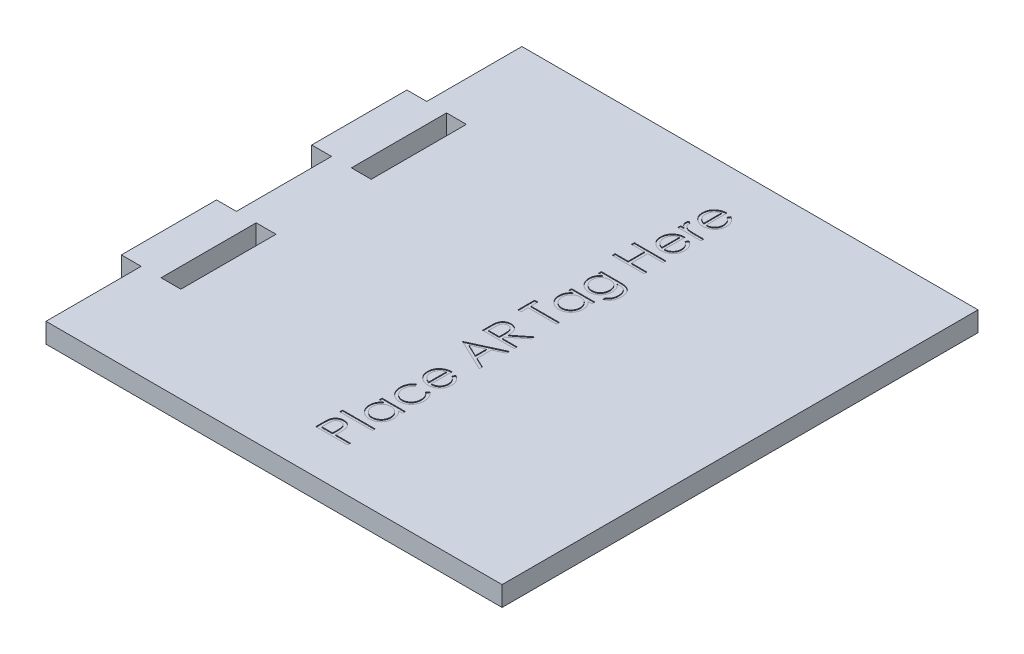
from build123d import *

# Parameters (mm, degrees)
SKETCH1_W           = 152.4
SKETCH1_H           = 152.4
BOSS_EXTRUDE1_DEPTH = 6.35
SKETCH2_W           = 6.35
SKETCH2_H           = 30.48
CUT_EXTRUDE1_DEPTH  = 108.95
SKETCH3_W           = 6.35
SKETCH3_H           = 30.48
CUT_EXTRUDE2_DEPTH  = 108.95
SKETCH4_W           = 10.420512821
SKETCH4_H           = 0.911794872
CUT_EXTRUDE3_DEPTH  = 0.254


with BuildPart() as part:
    # Sketch1 → Boss-Extrude1 (new body)
    with BuildSketch(Plane(origin=(0, 0, 0), x_dir=(1, 0, 0), z_dir=(0, 1, 0))):
        Rectangle(SKETCH1_W, SKETCH1_H)
    extrude(amount=BOSS_EXTRUDE1_DEPTH)

    # Sketch2 → Cut-Extrude1 (cut, through all)
    with BuildSketch(Plane(origin=(0, 6.35, 0), x_dir=(1, 0, 0), z_dir=(0, 1, 0))):
        with Locations((-60.325, -30.48)):
            Rectangle(SKETCH2_W, SKETCH2_H)
        with Locations((-60.325, 30.48)):
            Rectangle(SKETCH2_W, SKETCH2_H)
    extrude(amount=-CUT_EXTRUDE1_DEPTH, mode=Mode.SUBTRACT)

    # Sketch3 → Cut-Extrude2 (cut, through all)
    with BuildSketch(Plane(origin=(0, 6.35, 0), x_dir=(1, 0, 0), z_dir=(0, 1, 0))):
        with Locations((-73.025, -60.96)):
            Rectangle(SKETCH3_W, SKETCH3_H)
        with Locations((-73.025, 0)):
            Rectangle(SKETCH3_W, SKETCH3_H)
        with Locations((-73.025, 60.96)):
            Rectangle(SKETCH3_W, SKETCH3_H)
    extrude(amount=-CUT_EXTRUDE2_DEPTH, mode=Mode.SUBTRACT)

    # Sketch4 → Cut-Extrude3 (cut)
    # profile 1 of 14: a face of its own
    with BuildSketch(Plane(origin=(0, 6.35, 0), x_dir=(1, 0, 0), z_dir=(0, 1, 0))):
        with BuildLine():
            Line((2.54, -62.197435897), (2.54, -60.204919872))
            add(Edge.make_bspline(
                [(2.54, -60.204919872), (2.540150647, -60.067873356), (2.540439294, -59.805286145), (2.549190671, -59.428741869), (2.560879583, -59.086757048), (2.577083021, -58.780069085), (2.59623198, -58.507734354), (2.623089329, -58.270985165), (2.651131787, -58.067960624), (2.679641927, -57.946312188), (2.692644231, -57.890833333)],
                knots=[0, 0, 0, 0, 1.415646017, 2.712440637, 3.8905458, 4.950247383, 5.884950622, 6.709939814, 7.411656543, 8, 8, 8, 8], degree=3))
            add(Edge.make_bspline(
                [(2.692644231, -57.890833333), (2.711867557, -57.820603574), (2.749861237, -57.68179893), (2.825945048, -57.481780182), (2.916212534, -57.291519636), (3.018893817, -57.110168106), (3.139043345, -56.941028623), (3.268668078, -56.778462828), (3.416144919, -56.628209284), (3.576822403, -56.488232825), (3.748662642, -56.358856468), (3.934787752, -56.250156934), (4.129640888, -56.155113448), (4.335870266, -56.077296522), (4.553676105, -56.019428623), (4.781510542, -55.976467538), (5.019629765, -55.949073964), (5.182365742, -55.946459253), (5.265208333, -55.945128205)],
                knots=[0, 0, 0, 0, 0.999549623, 1.97554611, 2.93413192, 3.889860808, 4.833293765, 5.780583482, 6.742559327, 7.719844669, 8.705620613, 9.691528643, 10.674968152, 11.680406189, 12.713313868, 13.765869198, 14.862690416, 16, 16, 16, 16], degree=3))
            add(Edge.make_bspline(
                [(5.265208333, -55.945128205), (5.348746108, -55.946351541), (5.512193407, -55.94874508), (5.751309844, -55.977472583), (5.979818085, -56.016168225), (6.197211461, -56.075668239), (6.402198955, -56.153597393), (6.59791316, -56.245014324), (6.781024436, -56.355275086), (6.952197554, -56.481969792), (7.111593185, -56.622908134), (7.258056246, -56.777493806), (7.390729411, -56.945102724), (7.509910112, -57.125202217), (7.612834626, -57.319548064), (7.705021545, -57.525192715), (7.782443824, -57.743923629), (7.823171088, -57.895285898), (7.843878205, -57.97224359)],
                knots=[0, 0, 0, 0, 1.121902311, 2.195077645, 3.232258892, 4.234102512, 5.217864754, 6.176164875, 7.132989551, 8.084763148, 9.034132444, 9.988522005, 10.94243251, 11.903244335, 12.886203696, 13.894208494, 14.929344452, 16, 16, 16, 16], degree=3))
            add(Edge.make_bspline(
                [(7.843878205, -57.97224359), (7.857404085, -58.035896233), (7.887046838, -58.1753947), (7.920364461, -58.405120312), (7.947688553, -58.672724907), (7.973187614, -58.977297976), (7.986698929, -59.319549777), (8.002563416, -59.698695348), (8.010049001, -60.116017846), (8.010522183, -60.407087277), (8.010769231, -60.559054487)],
                knots=[0, 0, 0, 0, 0.601372724, 1.317943291, 2.144091499, 3.08771165, 4.142394186, 5.309582461, 6.595334295, 8, 8, 8, 8], degree=3))
            Line((8.010769231, -60.559054487), (8.010769231, -61.285641026))
            Line((8.010769231, -61.285641026), (12.7, -61.285641026))
            Line((12.7, -61.285641026), (12.7, -62.197435897))
            Line((12.7, -62.197435897), (2.54, -62.197435897))
        make_face()
        with BuildLine():
            Line((3.582051282, -61.285641026), (6.968717949, -61.285641026))
            Line((6.968717949, -61.285641026), (6.991105769, -59.506826923))
            add(Edge.make_bspline(
                [(6.991105769, -59.506826923), (6.991153595, -59.419973045), (6.991245922, -59.252303425), (6.979638098, -59.010108112), (6.966416742, -58.785372443), (6.946420207, -58.578941518), (6.920207916, -58.390091011), (6.887610311, -58.22045213), (6.852171529, -58.06748765), (6.792962117, -57.891531648), (6.701921569, -57.693751305), (6.569391741, -57.477691376), (6.397705679, -57.296001045), (6.205209305, -57.139063411), (5.991641735, -57.012071986), (5.761935228, -56.922484602), (5.519492864, -56.867320389), (5.353695698, -56.860430907), (5.269278846, -56.856923077)],
                knots=[0, 0, 0, 0, 1.160746174, 2.240796558, 3.240300023, 4.169675897, 5.012224395, 5.787635701, 6.478238024, 7.109103438, 8.265591281, 9.382545711, 10.479929969, 11.588830844, 12.694575677, 13.785760505, 14.872603606, 16, 16, 16, 16], degree=3))
            add(Edge.make_bspline(
                [(5.269278846, -56.856923077), (5.187596841, -56.860588396), (5.025223125, -56.867874596), (4.787249316, -56.922029366), (4.560146735, -57.013033988), (4.348299055, -57.139174434), (4.156226251, -57.292303435), (3.989089174, -57.470141548), (3.855626199, -57.673143737), (3.766165576, -57.860408454), (3.71378954, -58.028101704), (3.675960237, -58.173040809), (3.649874326, -58.337529743), (3.624913362, -58.520005611), (3.604764882, -58.720236733), (3.590773009, -58.93949573), (3.582670228, -59.177052449), (3.582262592, -59.341964646), (3.582051282, -59.427451923)],
                knots=[0, 0, 0, 0, 1.120540835, 2.227496496, 3.330685923, 4.466139262, 5.598993257, 6.692710361, 7.80064471, 8.921224235, 9.527843361, 10.209888745, 10.975318552, 11.811557897, 12.738105936, 13.73658638, 14.826690375, 16, 16, 16, 16], degree=3))
            Line((3.582051282, -59.427451923), (3.582051282, -61.285641026))
        make_face(mode=Mode.SUBTRACT)
    # profile 2 of 14: a face of its own
    with BuildSketch(Plane(origin=(0, 6.35, 0), x_dir=(1, 0, 0), z_dir=(0, 1, 0))):
        with Locations((7.48974359, -53.795897436)):
            Rectangle(SKETCH4_W, SKETCH4_H)
    # profile 3 of 14: a face of its own
    with BuildSketch(Plane(origin=(0, 6.35, 0), x_dir=(1, 0, 0), z_dir=(0, 1, 0))):
        with BuildLine():
            Line((5.275384615, -43.701025641), (12.7, -43.701025641))
            Line((12.7, -43.701025641), (12.7, -44.612820513))
            Line((12.7, -44.612820513), (11.415753205, -44.612820513))
            add(Edge.make_bspline(
                [(11.415753205, -44.612820513), (11.531790912, -44.715796714), (11.75857671, -44.917054915), (12.057573273, -45.25002661), (12.299678433, -45.607364176), (12.498054277, -45.980100965), (12.64646541, -46.371888027), (12.752141112, -46.780677615), (12.820035946, -47.20686028), (12.826819024, -47.497877143), (12.83025641, -47.645352564)],
                knots=[0, 0, 0, 0, 1.074325654, 2.099677833, 3.090439787, 4.057542011, 5.018572219, 5.985274637, 6.979019747, 8, 8, 8, 8], degree=3))
            add(Edge.make_bspline(
                [(12.83025641, -47.645352564), (12.826696427, -47.776468682), (12.819675982, -48.035035471), (12.765211695, -48.415394163), (12.677746804, -48.78142195), (12.556114508, -49.13346471), (12.394771323, -49.469244423), (12.201611586, -49.791636018), (11.971586776, -50.098969318), (11.708622671, -50.386559843), (11.42299608, -50.651393307), (11.118354149, -50.883799744), (10.796014204, -51.077574399), (10.460057392, -51.239612119), (10.107897511, -51.364424364), (9.740752361, -51.451433542), (9.359056042, -51.505834382), (9.099135598, -51.512851925), (8.967339744, -51.516410256)],
                knots=[0, 0, 0, 0, 1.033919861, 2.038935746, 3.024066025, 3.998881131, 4.97069526, 5.957263378, 6.95902576, 7.993208707, 9.027059324, 10.027763471, 11.009749337, 11.988697705, 12.965288445, 13.950418724, 14.960734635, 16, 16, 16, 16], degree=3))
            add(Edge.make_bspline(
                [(8.967339744, -51.516410256), (8.838267964, -51.512773059), (8.583100019, -51.505582517), (8.207822427, -51.452015456), (7.846363704, -51.361936871), (7.499887549, -51.235523691), (7.167974718, -51.073422473), (6.850390463, -50.87623694), (6.546259869, -50.643952852), (6.26273425, -50.376157294), (6.000836696, -50.086060932), (5.773226438, -49.775720159), (5.5766541, -49.452854863), (5.420905723, -49.112457095), (5.294895294, -48.759565156), (5.207713878, -48.39103744), (5.156341082, -48.008407257), (5.148901744, -47.748629143), (5.145128205, -47.616858974)],
                knots=[0, 0, 0, 0, 1.020392517, 2.01726096, 2.990465484, 3.961182959, 4.928053699, 5.906110375, 6.912531644, 7.948652711, 8.985773172, 9.998621852, 10.987621588, 11.969261332, 12.953316658, 13.946091881, 14.958173133, 16, 16, 16, 16], degree=3))
            add(Edge.make_bspline(
                [(5.145128205, -47.616858974), (5.149306441, -47.465333111), (5.157499766, -47.168198043), (5.225542983, -46.733518445), (5.340847498, -46.322492743), (5.496609811, -45.930757502), (5.707927094, -45.563704857), (5.967036679, -45.216765548), (6.28465107, -44.897320733), (6.525570182, -44.70929441), (6.649182692, -44.612820513)],
                knots=[0, 0, 0, 0, 1.039007978, 2.037445607, 3.008437381, 3.96246474, 4.921201921, 5.904967172, 6.925065498, 8, 8, 8, 8], degree=3))
            Line((6.649182692, -44.612820513), (5.275384615, -44.612820513))
            Line((5.275384615, -44.612820513), (5.275384615, -43.701025641))
        make_face()
        with BuildLine():
            add(Edge.make_bspline(
                [(6.056923077, -47.604647436), (6.061669353, -47.737927331), (6.071037746, -48.001000645), (6.144054111, -48.387249859), (6.265859664, -48.756666636), (6.431468586, -49.108676532), (6.643660878, -49.433463525), (6.893662577, -49.728827605), (7.185693617, -49.985661545), (7.509303045, -50.206538112), (7.858146051, -50.383852602), (8.222689526, -50.509326479), (8.596624587, -50.591925744), (8.850221629, -50.600374491), (8.977516026, -50.604615385)],
                knots=[0, 0, 0, 0, 1.031130969, 2.035288524, 3.029955243, 4.035265425, 5.037320146, 6.024362013, 7.021230137, 8.037832003, 9.049975902, 10.039737725, 11.016035826, 12, 12, 12, 12], degree=3))
            add(Edge.make_bspline(
                [(8.977516026, -50.604615385), (9.104043888, -50.599180019), (9.356603667, -50.588330593), (9.730506631, -50.511134929), (10.09423181, -50.37992717), (10.445878072, -50.202852447), (10.772649524, -49.979376331), (11.069925778, -49.722786657), (11.323838054, -49.426001505), (11.536541892, -49.098310708), (11.708253936, -48.74817041), (11.827759334, -48.379998179), (11.904908887, -48.000663226), (11.913921002, -47.742737897), (11.918461538, -47.612788462)],
                knots=[0, 0, 0, 0, 0.979154007, 1.954470061, 2.941101473, 3.965068436, 4.993389179, 5.998216918, 6.996159742, 8.005560442, 9.015493761, 10.005250788, 10.994993882, 12, 12, 12, 12], degree=3))
            add(Edge.make_bspline(
                [(11.918461538, -47.612788462), (11.913587233, -47.480881732), (11.903892723, -47.218532329), (11.83128946, -46.830705891), (11.70678793, -46.455627829), (11.539470753, -46.09585677), (11.331072902, -45.761027371), (11.087095315, -45.461531975), (10.805302352, -45.205290616), (10.49201069, -44.991950934), (10.150739255, -44.822762143), (9.787768052, -44.699053461), (9.402360326, -44.626724277), (9.138605844, -44.617519184), (9.003974359, -44.612820513)],
                knots=[0, 0, 0, 0, 1.01787422, 2.024450869, 3.03297362, 4.061474925, 5.080076323, 6.069755756, 7.033548292, 8.009625779, 8.9862229, 9.964937832, 10.961217871, 12, 12, 12, 12], degree=3))
            add(Edge.make_bspline(
                [(9.003974359, -44.612820513), (8.901393685, -44.615606258), (8.699482457, -44.621089487), (8.403020863, -44.662979368), (8.119313818, -44.729614241), (7.848063041, -44.823510551), (7.590768254, -44.94685668), (7.345582024, -45.095621623), (7.113779559, -45.272421443), (6.898552816, -45.474410069), (6.702242857, -45.695506771), (6.527014089, -45.929461209), (6.383064966, -46.179045229), (6.263928018, -46.440061542), (6.169123171, -46.712963016), (6.105876609, -46.999970301), (6.062448934, -47.298032731), (6.058784423, -47.501366424), (6.056923077, -47.604647436)],
                knots=[0, 0, 0, 0, 1.050140795, 2.067009409, 3.05949893, 4.030605086, 5.00011959, 5.97591094, 6.962425594, 7.979863591, 8.993523472, 9.986985069, 10.967611495, 11.937549037, 12.921786183, 13.919465291, 14.943216303, 16, 16, 16, 16], degree=3))
        make_face(mode=Mode.SUBTRACT)
    # profile 4 of 14: a face of its own
    with BuildSketch(Plane(origin=(0, 6.35, 0), x_dir=(1, 0, 0), z_dir=(0, 1, 0))):
        with BuildLine():
            Line((6.885272436, -34.322564103), (7.359487179, -35.085785256))
            add(Edge.make_bspline(
                [(7.359487179, -35.085785256), (7.255482471, -35.169474237), (7.050766859, -35.334201787), (6.786578024, -35.620247113), (6.559670268, -35.925080247), (6.37474738, -36.253910237), (6.231864541, -36.606275873), (6.13075743, -36.980787556), (6.067753114, -37.377391879), (6.060592239, -37.649288571), (6.056923077, -37.788605769)],
                knots=[0, 0, 0, 0, 1.026593902, 2.0206758, 2.988051866, 3.946915611, 4.916868779, 5.907761954, 6.927957743, 8, 8, 8, 8], degree=3))
            add(Edge.make_bspline(
                [(6.056923077, -37.788605769), (6.059990939, -37.899956341), (6.06603301, -38.119258265), (6.103800613, -38.441202985), (6.172429986, -38.747867644), (6.262856763, -39.041174388), (6.38405189, -39.319037089), (6.531545354, -39.582183755), (6.702959185, -39.832948491), (6.901545225, -40.064064518), (7.117513929, -40.275476721), (7.349027514, -40.458643854), (7.589151541, -40.618117923), (7.843882312, -40.743248357), (8.107392227, -40.845647137), (8.384655305, -40.913012931), (8.672119464, -40.957904732), (8.868115559, -40.96304084), (8.967339744, -40.965641026)],
                knots=[0, 0, 0, 0, 1.112346261, 2.190735716, 3.231507886, 4.247384806, 5.251966152, 6.253067467, 7.256802811, 8.280671706, 9.291813951, 10.270744147, 11.225547591, 12.165006084, 13.100104208, 14.043489273, 15.009504848, 16, 16, 16, 16], degree=3))
            add(Edge.make_bspline(
                [(8.967339744, -40.965641026), (9.097279795, -40.960397832), (9.356074004, -40.949955262), (9.737439081, -40.870531423), (10.105476011, -40.73763442), (10.45819512, -40.55809673), (10.785011473, -40.330203243), (11.078159542, -40.062662144), (11.33191377, -39.75518811), (11.542291712, -39.410526788), (11.711415987, -39.036760993), (11.831905886, -38.63793727), (11.904629333, -38.217313874), (11.913790587, -37.929330864), (11.918461538, -37.7825)],
                knots=[0, 0, 0, 0, 0.96628757, 1.924499989, 2.884001032, 3.87047137, 4.860396324, 5.839257425, 6.814467993, 7.816059692, 8.834901047, 9.858382822, 10.908076205, 12, 12, 12, 12], degree=3))
            add(Edge.make_bspline(
                [(11.918461538, -37.7825), (11.914689284, -37.647937522), (11.907275802, -37.383486544), (11.844780297, -36.996920939), (11.742473064, -36.62889697), (11.599804457, -36.279427715), (11.415393153, -35.949151759), (11.187927675, -35.640203068), (10.923951715, -35.346434105), (10.71982869, -35.173722881), (10.615897436, -35.085785256)],
                knots=[0, 0, 0, 0, 1.039848629, 2.043578496, 3.018386758, 3.987534228, 4.954977003, 5.934852016, 6.948509513, 8, 8, 8, 8], degree=3))
            Line((10.615897436, -35.085785256), (11.116570513, -34.322564103))
            add(Edge.make_bspline(
                [(11.116570513, -34.322564103), (11.183019023, -34.367812975), (11.315695492, -34.458160534), (11.502767557, -34.609189298), (11.677872783, -34.772097153), (11.840776453, -34.946248542), (11.995376874, -35.129369508), (12.134283159, -35.327715668), (12.265303101, -35.534891455), (12.383196468, -35.75332901), (12.489169104, -35.980769893), (12.580293188, -36.216894069), (12.658583553, -36.460675468), (12.720813108, -36.71240072), (12.770483428, -36.972566093), (12.803441601, -37.240498746), (12.828044132, -37.5161064), (12.829512591, -37.702388988), (12.83025641, -37.796746795)],
                knots=[0, 0, 0, 0, 0.954134338, 1.905101784, 2.851144739, 3.791306361, 4.734911809, 5.6936923, 6.663572882, 7.643865596, 8.638447847, 9.640600242, 10.646758161, 11.676244097, 12.717260333, 13.78922464, 14.880174919, 16, 16, 16, 16], degree=3))
            add(Edge.make_bspline(
                [(12.83025641, -37.796746795), (12.827664854, -37.940758219), (12.822585385, -38.223021655), (12.766886567, -38.636190143), (12.682606534, -39.030921869), (12.562667725, -39.407910511), (12.404274762, -39.764851311), (12.215227116, -40.104715807), (11.98927731, -40.423996827), (11.731793156, -40.720601266), (11.4523358, -40.991845927), (11.152520027, -41.227871443), (10.838970892, -41.427895693), (10.509712023, -41.592669133), (10.166093532, -41.721506589), (9.806016229, -41.810206592), (9.432535183, -41.867438845), (9.177862172, -41.874072711), (9.04875, -41.877435897)],
                knots=[0, 0, 0, 0, 1.113096611, 2.181677437, 3.217994567, 4.231807234, 5.234933164, 6.233258928, 7.234764453, 8.254006763, 9.267004511, 10.242118657, 11.199842941, 12.138404996, 13.084707599, 14.031460992, 15.002005182, 16, 16, 16, 16], degree=3))
            add(Edge.make_bspline(
                [(9.04875, -41.877435897), (8.961146316, -41.876155691), (8.786888128, -41.873609148), (8.528257878, -41.844400809), (8.273071929, -41.806668099), (8.024564949, -41.742730531), (7.778967879, -41.668880012), (7.539240933, -41.574608182), (7.304270112, -41.464022693), (7.074660702, -41.338468469), (6.854190039, -41.197131997), (6.645899401, -41.040722474), (6.447286596, -40.875130916), (6.265208479, -40.692610545), (6.092383421, -40.500906864), (5.933428409, -40.294596233), (5.787876275, -40.074861989), (5.653035613, -39.845004115), (5.532975082, -39.605156382), (5.429536883, -39.356768562), (5.341137405, -39.101337368), (5.271152657, -38.838454207), (5.212464365, -38.569863944), (5.175546274, -38.293450003), (5.149460407, -38.010269838), (5.146584279, -37.818518641), (5.145128205, -37.721442308)],
                knots=[0, 0, 0, 0, 0.990994727, 1.971252077, 2.943264845, 3.907940874, 4.872158414, 5.844625996, 6.82015047, 7.809835459, 8.804511986, 9.781214284, 10.756496977, 11.728388426, 12.696359165, 13.676225489, 14.672885716, 15.677705647, 16.690706858, 17.706033469, 18.721040654, 19.747369689, 20.783475414, 21.830280724, 22.901553713, 24, 24, 24, 24], degree=3))
            add(Edge.make_bspline(
                [(5.145128205, -37.721442308), (5.147804046, -37.599870186), (5.153142353, -37.357333617), (5.198078784, -36.997553695), (5.265805592, -36.643062292), (5.366223015, -36.300129456), (5.487540781, -35.972729834), (5.624595564, -35.6670719), (5.780378585, -35.387771694), (5.953936093, -35.132365636), (6.151645794, -34.900924493), (6.371495255, -34.687516357), (6.615066962, -34.490735166), (6.794460615, -34.379083758), (6.885272436, -34.322564103)],
                knots=[0, 0, 0, 0, 1.095139042, 2.184804066, 3.262657822, 4.34424993, 5.400369085, 6.407210964, 7.359649996, 8.278719237, 9.185177137, 10.097389079, 11.036869154, 12, 12, 12, 12], degree=3))
        make_face()
    # profile 5 of 14: a face of its own
    with BuildSketch(Plane(origin=(0, 6.35, 0), x_dir=(1, 0, 0), z_dir=(0, 1, 0))):
        with BuildLine():
            Line((10.355384615, -26.405416667), (10.780753205, -25.595384615))
            add(Edge.make_bspline(
                [(10.780753205, -25.595384615), (10.895224419, -25.659968139), (11.11794007, -25.7856221), (11.423941762, -26.000830995), (11.697586949, -26.228497631), (11.934493783, -26.475548998), (12.143711935, -26.734540393), (12.324174291, -27.010390869), (12.479137043, -27.300848826), (12.606114558, -27.609113514), (12.705938819, -27.934815662), (12.779659717, -28.279845226), (12.822410833, -28.645831306), (12.827599533, -28.896458078), (12.83025641, -29.024791667)],
                knots=[0, 0, 0, 0, 1.120611642, 2.180266485, 3.186550691, 4.152466804, 5.095166165, 6.022949561, 6.960161436, 7.899497276, 8.862391909, 9.862399089, 10.905440174, 12, 12, 12, 12], degree=3))
            add(Edge.make_bspline(
                [(12.83025641, -29.024791667), (12.826926324, -29.167443807), (12.820430291, -29.445716806), (12.764427024, -29.850780761), (12.673067258, -30.232156432), (12.545441589, -30.589822448), (12.378738209, -30.922902662), (12.175656057, -31.232059998), (11.937236984, -31.518916811), (11.661421129, -31.774446689), (11.366240665, -32.004450035), (11.058710212, -32.207544313), (10.73989478, -32.376547869), (10.411691253, -32.516122986), (10.074845439, -32.626221305), (9.727428184, -32.704458868), (9.370817096, -32.749142979), (9.129602416, -32.75602105), (9.008044872, -32.759487179)],
                knots=[0, 0, 0, 0, 1.14524686, 2.234044844, 3.276713788, 4.290115724, 5.276966211, 6.260758605, 7.254862358, 8.264742877, 9.274005885, 10.257798278, 11.220590477, 12.167824544, 13.118936889, 14.062732937, 15.023735098, 16, 16, 16, 16], degree=3))
            add(Edge.make_bspline(
                [(9.008044872, -32.759487179), (8.893977593, -32.756412644), (8.667911309, -32.750319319), (8.3333119, -32.711912234), (8.008109306, -32.643845189), (7.692033308, -32.550441917), (7.385613125, -32.429824585), (7.088662266, -32.282265914), (6.801496717, -32.10753604), (6.620349335, -31.972632508), (6.529102564, -31.904679487)],
                knots=[0, 0, 0, 0, 1.024358464, 2.0301432, 3.019427413, 4.004406732, 4.986367066, 5.972626655, 6.978780325, 8, 8, 8, 8], degree=3))
            add(Edge.make_bspline(
                [(6.529102564, -31.904679487), (6.418992377, -31.812795294), (6.202613705, -31.632232712), (5.920891931, -31.323668402), (5.679903037, -30.994049612), (5.48330382, -30.640060773), (5.332087939, -30.262298158), (5.224530082, -29.86271024), (5.157602671, -29.440192566), (5.149349579, -29.150552078), (5.145128205, -29.002403846)],
                knots=[0, 0, 0, 0, 1.030811313, 2.025658015, 2.997072178, 3.962767568, 4.930766827, 5.917075773, 6.934604948, 8, 8, 8, 8], degree=3))
            add(Edge.make_bspline(
                [(5.145128205, -29.002403846), (5.149039129, -28.850147186), (5.156711472, -28.551454327), (5.228476346, -28.116056203), (5.340900333, -27.703264384), (5.504696746, -27.316485429), (5.707733587, -26.949759645), (5.964362647, -26.611527183), (6.261403155, -26.292503344), (6.490078068, -26.107005301), (6.606442308, -26.012612179)],
                knots=[0, 0, 0, 0, 1.056389096, 2.072394598, 3.055233004, 4.020130009, 4.981825462, 5.957811105, 6.960805292, 8, 8, 8, 8], degree=3))
            add(Edge.make_bspline(
                [(6.606442308, -26.012612179), (6.69411899, -25.948380839), (6.868888751, -25.8203457), (7.153865596, -25.659971261), (7.452019778, -25.520757794), (7.768170812, -25.409482685), (8.098572794, -25.319379447), (8.445587723, -25.25419051), (8.809112266, -25.215960989), (9.056803067, -25.20844637), (9.183076923, -25.204615385)],
                knots=[0, 0, 0, 0, 0.94817472, 1.890038105, 2.849395472, 3.817997239, 4.812318967, 5.836947057, 6.897266129, 8, 8, 8, 8], degree=3))
            Line((9.183076923, -25.204615385), (9.183076923, -31.847692308))
            add(Edge.make_bspline(
                [(9.183076923, -31.847692308), (9.280904556, -31.84322305), (9.473278652, -31.834434436), (9.754770982, -31.793460191), (10.022917598, -31.728875179), (10.275707229, -31.638105558), (10.516441542, -31.528183515), (10.743334769, -31.393532406), (10.955353446, -31.232889587), (11.154394051, -31.053708699), (11.331644718, -30.854261817), (11.490291017, -30.644435328), (11.623258121, -30.421224293), (11.731186029, -30.186388714), (11.815677507, -29.940308332), (11.873350952, -29.682905617), (11.911979582, -29.414687085), (11.916274839, -29.231848497), (11.918461538, -29.138766026)],
                knots=[0, 0, 0, 0, 1.094153842, 2.151609401, 3.174256925, 4.172055639, 5.149267565, 6.128595816, 7.11444997, 8.118368179, 9.117203808, 10.09244225, 11.054858984, 12.015122123, 12.976791628, 13.957293641, 14.960065497, 16, 16, 16, 16], degree=3))
            add(Edge.make_bspline(
                [(11.918461538, -29.138766026), (11.916710651, -29.047754152), (11.913236553, -28.867169136), (11.878971113, -28.598304455), (11.824663363, -28.333329274), (11.746443686, -28.074874724), (11.6548495, -27.826707456), (11.547043734, -27.595621396), (11.424132958, -27.384671618), (11.284460256, -27.186742233), (11.113045168, -26.995799818), (10.901191102, -26.803385356), (10.646495204, -26.601620167), (10.456073067, -26.473278942), (10.355384615, -26.405416667)],
                knots=[0, 0, 0, 0, 0.991168677, 1.966668791, 2.94808785, 3.9350306, 4.905702032, 5.828266021, 6.709360349, 7.562606342, 8.463112863, 9.498839253, 10.677475166, 12, 12, 12, 12], degree=3))
        make_face()
        with BuildLine():
            add(Edge.make_bspline(
                [(8.271282051, -26.116410256), (8.150280243, -26.149648168), (7.917996082, -26.213454161), (7.596451066, -26.349340111), (7.309034025, -26.498686448), (7.060521189, -26.678470051), (6.839455183, -26.880180356), (6.649357015, -27.116388), (6.474147177, -27.376848388), (6.328239093, -27.666749362), (6.208337769, -27.974658675), (6.120173231, -28.294247573), (6.068347474, -28.622839207), (6.060749111, -28.844153636), (6.056923077, -28.955592949)],
                knots=[0, 0, 0, 0, 1.155085888, 2.217389643, 3.210301801, 4.133263417, 5.03575695, 5.95948047, 6.920061569, 7.923798377, 8.943125483, 9.960783337, 10.973185325, 12, 12, 12, 12], degree=3))
            add(Edge.make_bspline(
                [(6.056923077, -28.955592949), (6.058677967, -29.046602844), (6.062147015, -29.226510274), (6.095742319, -29.491443757), (6.149726241, -29.746533294), (6.229101288, -29.991017455), (6.325685032, -30.226517993), (6.444405996, -30.452864739), (6.58794172, -30.667147966), (6.697587909, -30.80107468), (6.752980769, -30.868733974)],
                knots=[0, 0, 0, 0, 1.048823158, 2.073302879, 3.073550078, 4.050623576, 5.03253758, 6.005186856, 6.992227572, 8, 8, 8, 8], degree=3))
            add(Edge.make_bspline(
                [(6.752980769, -30.868733974), (6.796792806, -30.917199782), (6.88545769, -31.015282764), (7.038304638, -31.146200714), (7.203217547, -31.27248484), (7.387395015, -31.384706687), (7.585496097, -31.491356893), (7.798966288, -31.588542883), (8.028706649, -31.676908886), (8.188876762, -31.726514077), (8.271282051, -31.752035256)],
                knots=[0, 0, 0, 0, 0.879905587, 1.780714457, 2.708106151, 3.677566983, 4.684151534, 5.740052498, 6.837288539, 8, 8, 8, 8], degree=3))
            Line((8.271282051, -31.752035256), (8.271282051, -26.116410256))
        make_face(mode=Mode.SUBTRACT)
    # profile 6 of 14: a face of its own
    with BuildSketch(Plane(origin=(0, 6.35, 0), x_dir=(1, 0, 0), z_dir=(0, 1, 0))):
        Polygon((2.54, -15.044615385), (12.7, -10.355384615), (12.7, -11.346554487), (9.443589744, -12.848573718), (9.443589744, -17.454358974), (12.7, -18.99911859), (12.7, -19.994358974), (2.54, -15.174871795), align=None)
        Polygon((4.520304487, -15.119919872), (8.401538462, -16.959791667), (8.401538462, -13.328894231), align=None, mode=Mode.SUBTRACT)
    # profile 7 of 14: a face of its own
    with BuildSketch(Plane(origin=(0, 6.35, 0), x_dir=(1, 0, 0), z_dir=(0, 1, 0))):
        with BuildLine():
            Line((2.54, -8.792307692), (2.54, -6.759086538))
            add(Edge.make_bspline(
                [(2.54, -6.759086538), (2.540451644, -6.62340372), (2.54131885, -6.362877678), (2.546154322, -5.989647841), (2.560013595, -5.650515468), (2.571940225, -5.345657878), (2.593688261, -5.075080662), (2.614474596, -4.837954127), (2.641684995, -4.63537041), (2.666955594, -4.512736739), (2.678397436, -4.457211538)],
                knots=[0, 0, 0, 0, 1.410062039, 2.707475311, 3.878576406, 4.937260626, 5.877586885, 6.699081471, 7.410979367, 8, 8, 8, 8], degree=3))
            add(Edge.make_bspline(
                [(2.678397436, -4.457211538), (2.696763181, -4.382879224), (2.733102881, -4.235800307), (2.809910605, -4.024035848), (2.898797648, -3.822248789), (3.003185539, -3.631259049), (3.123907027, -3.452090751), (3.258663138, -3.282644192), (3.407181693, -3.123469405), (3.570801537, -2.976643745), (3.746036514, -2.843274494), (3.932405682, -2.726289118), (4.129138446, -2.627438627), (4.33654123, -2.549866364), (4.552322959, -2.484774711), (4.778686009, -2.441041139), (5.014874711, -2.413799397), (5.175580741, -2.411108181), (5.257067308, -2.40974359)],
                knots=[0, 0, 0, 0, 1.02737844, 2.032840108, 3.019645024, 3.985760442, 4.950801802, 5.916702504, 6.889791722, 7.870143693, 8.864820395, 9.842884691, 10.820524757, 11.815201459, 12.812418953, 13.84314332, 14.906358105, 16, 16, 16, 16], degree=3))
            add(Edge.make_bspline(
                [(5.257067308, -2.40974359), (5.392442354, -2.414007881), (5.656594133, -2.422328619), (6.039948006, -2.499907777), (6.397548988, -2.62698476), (6.728946817, -2.80209465), (7.027681719, -3.025090614), (7.290072298, -3.293096293), (7.509644158, -3.6062612), (7.661907157, -3.897793157), (7.759422572, -4.155317805), (7.828035545, -4.367323079), (7.881047421, -4.598584934), (7.928538546, -4.846887596), (7.964393751, -5.113264379), (7.990654722, -5.397076836), (8.007067618, -5.698527379), (8.009511838, -5.905614507), (8.010769231, -6.012147436)],
                knots=[0, 0, 0, 0, 1.260483769, 2.459530307, 3.627416485, 4.787058657, 5.939039949, 7.08810263, 8.267026773, 9.491475466, 10.141966685, 10.831826277, 11.566392101, 12.351337768, 13.187381173, 14.07005841, 15.007169909, 16, 16, 16, 16], degree=3))
            Line((8.010769231, -6.012147436), (12.7, -2.279487179))
            Line((12.7, -2.279487179), (12.7, -3.407019231))
            Line((12.7, -3.407019231), (8.010769231, -7.139679487))
            Line((8.010769231, -7.139679487), (8.010769231, -7.880512821))
            Line((8.010769231, -7.880512821), (12.7, -7.880512821))
            Line((12.7, -7.880512821), (12.7, -8.792307692))
            Line((12.7, -8.792307692), (2.54, -8.792307692))
        make_face()
        with BuildLine():
            Line((3.582051282, -7.880512821), (6.968717949, -7.880512821))
            Line((6.968717949, -7.880512821), (6.982964744, -6.020288462))
            add(Edge.make_bspline(
                [(6.982964744, -6.020288462), (6.98300319, -5.933434852), (6.98307771, -5.765087818), (6.971484046, -5.521536327), (6.958296471, -5.294764282), (6.93812008, -5.085642009), (6.912133166, -4.894066373), (6.879575704, -4.720164931), (6.841807345, -4.56355006), (6.782745015, -4.381483378), (6.693257974, -4.175774207), (6.554268522, -3.95710095), (6.38726247, -3.765232712), (6.190778502, -3.608970282), (5.978176861, -3.478047823), (5.747280109, -3.389942216), (5.505578313, -3.33122357), (5.339510355, -3.324804052), (5.255032051, -3.321538462)],
                knots=[0, 0, 0, 0, 1.146477201, 2.22219935, 3.21835465, 4.145220026, 4.995151787, 5.769831222, 6.480173269, 7.120302478, 8.295254187, 9.430763426, 10.528629691, 11.636497428, 12.733230534, 13.811001502, 14.886462612, 16, 16, 16, 16], degree=3))
            add(Edge.make_bspline(
                [(5.255032051, -3.321538462), (5.173333231, -3.325038119), (5.01143598, -3.331973163), (4.774302866, -3.388282502), (4.550427197, -3.484548949), (4.339519917, -3.611187887), (4.151062644, -3.770120294), (3.98806504, -3.952897334), (3.854629061, -4.159483832), (3.765942676, -4.350866337), (3.713861073, -4.523298145), (3.676006532, -4.672299002), (3.649734069, -4.841483547), (3.624849257, -5.03008238), (3.60470433, -5.238455431), (3.590808634, -5.467213424), (3.582670689, -5.714939276), (3.582262556, -5.886633592), (3.582051282, -5.975512821)],
                knots=[0, 0, 0, 0, 1.100823979, 2.181431445, 3.263702604, 4.376021382, 5.48638238, 6.575013887, 7.666064109, 8.791843368, 9.405226397, 10.093019944, 10.863016055, 11.711746407, 12.658404307, 13.684961631, 14.801597923, 16, 16, 16, 16], degree=3))
            Line((3.582051282, -5.975512821), (3.582051282, -7.880512821))
        make_face(mode=Mode.SUBTRACT)
    # profile 8 of 14: a face of its own
    with BuildSketch(Plane(origin=(0, 6.35, 0), x_dir=(1, 0, 0), z_dir=(0, 1, 0))):
        Polygon((3.582051282, 2.54), (2.54, 2.54), (2.54, 7.880512821), (3.582051282, 7.880512821), (3.582051282, 5.666153846), (12.7, 5.666153846), (12.7, 4.754358974), (3.582051282, 4.754358974), align=None)
    # profile 9 of 14: a face of its own
    with BuildSketch(Plane(origin=(0, 6.35, 0), x_dir=(1, 0, 0), z_dir=(0, 1, 0))):
        with BuildLine():
            Line((5.275384615, 16.998461538), (12.7, 16.998461538))
            Line((12.7, 16.998461538), (12.7, 16.086666667))
            Line((12.7, 16.086666667), (11.415753205, 16.086666667))
            add(Edge.make_bspline(
                [(11.415753205, 16.086666667), (11.531790912, 15.983690465), (11.75857671, 15.782432265), (12.057573273, 15.44946057), (12.299678433, 15.092123003), (12.498054277, 14.719386215), (12.64646541, 14.327599153), (12.752141112, 13.918809564), (12.820035946, 13.492626899), (12.826819024, 13.201610036), (12.83025641, 13.054134615)],
                knots=[0, 0, 0, 0, 1.074325654, 2.099677833, 3.090439787, 4.057542011, 5.018572219, 5.985274637, 6.979019747, 8, 8, 8, 8], degree=3))
            add(Edge.make_bspline(
                [(12.83025641, 13.054134615), (12.826696427, 12.923018498), (12.819675982, 12.664451709), (12.765211695, 12.284093016), (12.677746804, 11.918065229), (12.556114508, 11.56602247), (12.394771323, 11.230242756), (12.201611586, 10.907851161), (11.971586776, 10.600517861), (11.708622671, 10.312927337), (11.42299608, 10.048093873), (11.118354149, 9.815687436), (10.796014204, 9.621912781), (10.460057392, 9.459875061), (10.107897511, 9.335062815), (9.740752361, 9.248053637), (9.359056042, 9.193652797), (9.099135598, 9.186635254), (8.967339744, 9.183076923)],
                knots=[0, 0, 0, 0, 1.033919861, 2.038935746, 3.024066025, 3.998881131, 4.97069526, 5.957263378, 6.95902576, 7.993208707, 9.027059324, 10.027763471, 11.009749337, 11.988697705, 12.965288445, 13.950418724, 14.960734635, 16, 16, 16, 16], degree=3))
            add(Edge.make_bspline(
                [(8.967339744, 9.183076923), (8.838267964, 9.18671412), (8.583100019, 9.193904662), (8.207822427, 9.247471723), (7.846363704, 9.337550308), (7.499887549, 9.463963489), (7.167974718, 9.626064707), (6.850390463, 9.823250239), (6.546259869, 10.055534327), (6.26273425, 10.323329886), (6.000836696, 10.613426247), (5.773226438, 10.92376702), (5.5766541, 11.246632317), (5.420905723, 11.587030085), (5.294895294, 11.939922023), (5.207713878, 12.30844974), (5.156341082, 12.691079923), (5.148901744, 12.950858037), (5.145128205, 13.082628205)],
                knots=[0, 0, 0, 0, 1.020392517, 2.01726096, 2.990465484, 3.961182959, 4.928053699, 5.906110375, 6.912531644, 7.948652711, 8.985773172, 9.998621852, 10.987621588, 11.969261332, 12.953316658, 13.946091881, 14.958173133, 16, 16, 16, 16], degree=3))
            add(Edge.make_bspline(
                [(5.145128205, 13.082628205), (5.149306441, 13.234154069), (5.157499766, 13.531289136), (5.225542983, 13.965968734), (5.340847498, 14.376994437), (5.496609811, 14.768729678), (5.707927094, 15.135782322), (5.967036679, 15.482721631), (6.28465107, 15.802166446), (6.525570182, 15.990192769), (6.649182692, 16.086666667)],
                knots=[0, 0, 0, 0, 1.039007978, 2.037445607, 3.008437381, 3.96246474, 4.921201921, 5.904967172, 6.925065498, 8, 8, 8, 8], degree=3))
            Line((6.649182692, 16.086666667), (5.275384615, 16.086666667))
            Line((5.275384615, 16.086666667), (5.275384615, 16.998461538))
        make_face()
        with BuildLine():
            add(Edge.make_bspline(
                [(6.056923077, 13.094839744), (6.061669353, 12.961559848), (6.071037746, 12.698486534), (6.144054111, 12.312237321), (6.265859664, 11.942820543), (6.431468586, 11.590810647), (6.643660878, 11.266023654), (6.893662577, 10.970659574), (7.185693617, 10.713825635), (7.509303045, 10.492949067), (7.858146051, 10.315634578), (8.222689526, 10.1901607), (8.596624587, 10.107561436), (8.850221629, 10.099112689), (8.977516026, 10.094871795)],
                knots=[0, 0, 0, 0, 1.031130969, 2.035288524, 3.029955243, 4.035265425, 5.037320146, 6.024362013, 7.021230137, 8.037832003, 9.049975902, 10.039737725, 11.016035826, 12, 12, 12, 12], degree=3))
            add(Edge.make_bspline(
                [(8.977516026, 10.094871795), (9.104043888, 10.10030716), (9.356603667, 10.111156586), (9.730506631, 10.18835225), (10.09423181, 10.31956001), (10.445878072, 10.496634733), (10.772649524, 10.720110849), (11.069925778, 10.976700523), (11.323838054, 11.273485675), (11.536541892, 11.601176471), (11.708253936, 11.95131677), (11.827759334, 12.319489001), (11.904908887, 12.698823953), (11.913921002, 12.956749283), (11.918461538, 13.086698718)],
                knots=[0, 0, 0, 0, 0.979154007, 1.954470061, 2.941101473, 3.965068436, 4.993389179, 5.998216918, 6.996159742, 8.005560442, 9.015493761, 10.005250788, 10.994993882, 12, 12, 12, 12], degree=3))
            add(Edge.make_bspline(
                [(11.918461538, 13.086698718), (11.913587233, 13.218605448), (11.903892723, 13.480954851), (11.83128946, 13.868781288), (11.70678793, 14.24385935), (11.539470753, 14.603630409), (11.331072902, 14.938459809), (11.087095315, 15.237955205), (10.805302352, 15.494196564), (10.49201069, 15.707536245), (10.150739255, 15.876725037), (9.787768052, 16.000433719), (9.402360326, 16.072762902), (9.138605844, 16.081967996), (9.003974359, 16.086666667)],
                knots=[0, 0, 0, 0, 1.01787422, 2.024450869, 3.03297362, 4.061474925, 5.080076323, 6.069755756, 7.033548292, 8.009625779, 8.9862229, 9.964937832, 10.961217871, 12, 12, 12, 12], degree=3))
            add(Edge.make_bspline(
                [(9.003974359, 16.086666667), (8.901393685, 16.083880921), (8.699482457, 16.078397693), (8.403020863, 16.036507811), (8.119313818, 15.969872939), (7.848063041, 15.875976628), (7.590768254, 15.7526305), (7.345582024, 15.603865557), (7.113779559, 15.427065737), (6.898552816, 15.22507711), (6.702242857, 15.003980408), (6.527014089, 14.77002597), (6.383064966, 14.52044195), (6.263928018, 14.259425638), (6.169123171, 13.986524164), (6.105876609, 13.699516879), (6.062448934, 13.401454448), (6.058784423, 13.198120756), (6.056923077, 13.094839744)],
                knots=[0, 0, 0, 0, 1.050140795, 2.067009409, 3.05949893, 4.030605086, 5.00011959, 5.97591094, 6.962425594, 7.979863591, 8.993523472, 9.986985069, 10.967611495, 11.937549037, 12.921786183, 13.919465291, 14.943216303, 16, 16, 16, 16], degree=3))
        make_face(mode=Mode.SUBTRACT)
    # profile 10 of 14: a face of its own
    with BuildSketch(Plane(origin=(0, 6.35, 0), x_dir=(1, 0, 0), z_dir=(0, 1, 0))):
        with BuildLine():
            Line((5.275384615, 25.595384615), (5.275384615, 26.507179487))
            Line((5.275384615, 26.507179487), (11.167451923, 26.507179487))
            add(Edge.make_bspline(
                [(11.167451923, 26.507179487), (11.292964483, 26.506375272), (11.535233958, 26.504822943), (11.885545764, 26.493644124), (12.209115887, 26.470070958), (12.507420043, 26.443339472), (12.77907554, 26.404886147), (13.02489298, 26.357928463), (13.245108258, 26.304992892), (13.380743797, 26.258488489), (13.444903846, 26.236490385)],
                knots=[0, 0, 0, 0, 1.307562039, 2.523909702, 3.650326591, 4.686913197, 5.643429486, 6.506965704, 7.293745905, 8, 8, 8, 8], degree=3))
            add(Edge.make_bspline(
                [(13.444903846, 26.236490385), (13.528302509, 26.204009466), (13.692606267, 26.140018787), (13.925517846, 26.020174746), (14.144807818, 25.88595597), (14.349316249, 25.732696503), (14.537785005, 25.560903412), (14.714889835, 25.37562175), (14.873967731, 25.170351424), (15.016929316, 24.948686834), (15.148207803, 24.715103482), (15.260208552, 24.46784496), (15.353621938, 24.208239624), (15.430484947, 23.937485328), (15.492494657, 23.655597881), (15.533868418, 23.361638936), (15.561727698, 23.056601913), (15.564323871, 22.849209726), (15.565641026, 22.743990385)],
                knots=[0, 0, 0, 0, 0.98202571, 1.934689484, 2.871054655, 3.802072519, 4.735470746, 5.668036537, 6.612630213, 7.581518814, 8.561763468, 9.551722253, 10.55777311, 11.588015789, 12.63986657, 13.723744117, 14.845153492, 16, 16, 16, 16], degree=3))
            add(Edge.make_bspline(
                [(15.565641026, 22.743990385), (15.562842976, 22.5905165), (15.557379097, 22.290821071), (15.505152365, 21.852981512), (15.420909941, 21.438511495), (15.300884158, 21.050431709), (15.152461353, 20.692646751), (14.982435039, 20.367154708), (14.787377659, 20.076955939), (14.565311547, 19.815339004), (14.301255803, 19.579216208), (13.990073226, 19.357068351), (13.627021806, 19.14324118), (13.360560688, 19.017928788), (13.221025641, 18.952307692)],
                knots=[0, 0, 0, 0, 1.157856589, 2.260999188, 3.322382479, 4.345906448, 5.321474636, 6.242187631, 7.112686896, 7.955149481, 8.825136643, 9.778649332, 10.836767353, 12, 12, 12, 12], degree=3))
            Line((13.221025641, 18.952307692), (13.221025641, 19.864102564))
            add(Edge.make_bspline(
                [(13.221025641, 19.864102564), (13.337409944, 19.937468395), (13.564926925, 20.08088956), (13.859803644, 20.348201854), (14.109495354, 20.643305963), (14.312091532, 20.972463374), (14.468057166, 21.337969781), (14.576389166, 21.742189876), (14.641929401, 22.186229885), (14.649765562, 22.495450971), (14.653846154, 22.656474359)],
                knots=[0, 0, 0, 0, 0.997887113, 1.950746426, 2.877762071, 3.798308985, 4.747694893, 5.754452072, 6.830656281, 8, 8, 8, 8], degree=3))
            add(Edge.make_bspline(
                [(14.653846154, 22.656474359), (14.649712006, 22.815461821), (14.641741782, 23.121973733), (14.576363144, 23.562624268), (14.468023468, 23.965525849), (14.312409672, 24.32622857), (14.125492921, 24.642488424), (13.918768107, 24.916693111), (13.682901851, 25.13702724), (13.465939649, 25.285791413), (13.272521166, 25.378179), (13.106045524, 25.437067159), (12.918401175, 25.484559768), (12.709140354, 25.525328721), (12.478182744, 25.557633501), (12.224740713, 25.578828687), (11.950528481, 25.593871984), (11.760412788, 25.594868746), (11.662019231, 25.595384615)],
                knots=[0, 0, 0, 0, 1.570880491, 3.028500349, 4.391799536, 5.683507043, 6.897971719, 8.016608159, 9.065046722, 10.074948333, 10.602832593, 11.179761774, 11.817338097, 12.514350094, 13.286299219, 14.121078732, 15.027572402, 16, 16, 16, 16], degree=3))
            Line((11.662019231, 25.595384615), (11.277355769, 25.595384615))
            add(Edge.make_bspline(
                [(11.277355769, 25.595384615), (11.3874507, 25.502807119), (11.605704024, 25.319280536), (11.892205192, 25.003189173), (12.135972433, 24.655758752), (12.338737967, 24.281900315), (12.499386837, 23.88718561), (12.615790963, 23.478593236), (12.687993196, 23.057270268), (12.695969348, 22.772092115), (12.7, 22.627980769)],
                knots=[0, 0, 0, 0, 1.012670515, 2.007528466, 2.995541538, 3.996581493, 4.997861088, 5.991949332, 6.98525577, 8, 8, 8, 8], degree=3))
            add(Edge.make_bspline(
                [(12.7, 22.627980769), (12.698209326, 22.543144285), (12.694650503, 22.374538415), (12.673001952, 22.123343216), (12.630844916, 21.87698918), (12.576862636, 21.63390701), (12.504500899, 21.395794937), (12.419571358, 21.159799946), (12.315255418, 20.929349242), (12.197809985, 20.703266987), (12.065851876, 20.486872189), (11.923281572, 20.280845224), (11.770402982, 20.086453241), (11.605824916, 19.90549717), (11.429755042, 19.738227354), (11.244078341, 19.582390603), (11.046199933, 19.440564745), (10.839728562, 19.309839238), (10.623288845, 19.196460752), (10.401574147, 19.096938118), (10.17505853, 19.010405673), (9.942983628, 18.941418107), (9.70549575, 18.888728018), (9.462983956, 18.84950976), (9.214701459, 18.827265364), (9.047434914, 18.82379667), (8.963269231, 18.822051282)],
                knots=[0, 0, 0, 0, 1.028710361, 2.044481286, 3.053267669, 4.056977562, 5.061496029, 6.068537106, 7.095799505, 8.125955792, 9.155750787, 10.166547241, 11.162135275, 12.151998358, 13.129411568, 14.10464185, 15.088574784, 16.079052837, 17.065149435, 18.048153627, 19.024354702, 20.002874835, 20.980703288, 21.971932454, 22.97951087, 24, 24, 24, 24], degree=3))
            add(Edge.make_bspline(
                [(8.963269231, 18.822051282), (8.879077386, 18.823558348), (8.711019785, 18.826566642), (8.461724198, 18.852550056), (8.215766751, 18.889614286), (7.975682637, 18.948274552), (7.738737643, 19.018879361), (7.506681918, 19.106323788), (7.279444783, 19.211461673), (7.056857961, 19.330507117), (6.841908313, 19.464282655), (6.637760106, 19.610971228), (6.445915585, 19.770749926), (6.264439343, 19.941414458), (6.095082322, 20.12504867), (5.938255567, 20.321557562), (5.79133028, 20.529004094), (5.657475655, 20.748031197), (5.539090619, 20.975259273), (5.431067767, 21.204915384), (5.345334437, 21.440041689), (5.269793098, 21.676254547), (5.21627836, 21.917713956), (5.174993223, 22.161459305), (5.149840776, 22.408325062), (5.146701089, 22.57365118), (5.145128205, 22.656474359)],
                knots=[0, 0, 0, 0, 1.008818848, 2.013730394, 3.001654427, 3.987803273, 4.973046549, 5.963777569, 6.957074694, 7.972068341, 8.987420212, 9.989399531, 10.982630087, 11.977756091, 12.973280677, 13.973972381, 14.989194003, 16.018387222, 17.047741039, 18.059210846, 19.057554164, 20.045176975, 21.029480261, 22.018708529, 23.007435371, 24, 24, 24, 24], degree=3))
            add(Edge.make_bspline(
                [(5.145128205, 22.656474359), (5.149066434, 22.793056513), (5.156843226, 23.062764301), (5.217864608, 23.459674868), (5.315151001, 23.842684342), (5.454533517, 24.21395401), (5.644815914, 24.576508243), (5.895457157, 24.929152134), (6.208705457, 25.272905963), (6.448925201, 25.485040465), (6.573878205, 25.595384615)],
                knots=[0, 0, 0, 0, 0.96728863, 1.910097829, 2.838038873, 3.762875196, 4.71315279, 5.730631239, 6.819562287, 8, 8, 8, 8], degree=3))
            Line((6.573878205, 25.595384615), (5.275384615, 25.595384615))
        make_face()
        with BuildLine():
            add(Edge.make_bspline(
                [(6.056923077, 22.72974359), (6.061471257, 22.596421797), (6.070475689, 22.332472917), (6.146824485, 21.945432381), (6.267668715, 21.572645755), (6.43586973, 21.217788772), (6.648445945, 20.889035947), (6.901355964, 20.594828745), (7.19113012, 20.33832161), (7.514035435, 20.121278749), (7.862945224, 19.947894283), (8.230552889, 19.826777979), (8.610436935, 19.746721491), (8.869241382, 19.738165708), (8.999903846, 19.733846154)],
                knots=[0, 0, 0, 0, 1.026191648, 2.031641866, 3.026511193, 4.038688626, 5.047555432, 6.033268986, 7.01798463, 8.019529538, 9.022150945, 10.008736843, 10.994672018, 12, 12, 12, 12], degree=3))
            add(Edge.make_bspline(
                [(8.999903846, 19.733846154), (9.098404097, 19.735961387), (9.292125286, 19.740121433), (9.576470505, 19.779838342), (9.847707578, 19.844815629), (10.105578899, 19.934588022), (10.350117334, 20.049299561), (10.581305807, 20.190783151), (10.799273732, 20.358248694), (11.002181826, 20.549395002), (11.18697678, 20.760082278), (11.349357918, 20.988590628), (11.482165458, 21.234623609), (11.596946933, 21.492126645), (11.680778722, 21.76734877), (11.744754155, 22.056325533), (11.781355575, 22.361101432), (11.785892154, 22.568863966), (11.788205128, 22.674791667)],
                knots=[0, 0, 0, 0, 1.039710933, 2.044807362, 3.024849673, 3.981007225, 4.923240656, 5.871799057, 6.837597342, 7.820855272, 8.810901995, 9.792827897, 10.773995565, 11.758948565, 12.765014796, 13.806304263, 14.881544521, 16, 16, 16, 16], degree=3))
            add(Edge.make_bspline(
                [(11.788205128, 22.674791667), (11.785976869, 22.782092176), (11.781619531, 22.991917185), (11.744162518, 23.298374532), (11.683719296, 23.588755287), (11.597902056, 23.862793194), (11.488401203, 24.121522939), (11.349828622, 24.362038049), (11.192016442, 24.589495624), (11.007940424, 24.796633087), (10.805074267, 24.983937522), (10.5843268, 25.147167405), (10.349019693, 25.286256205), (10.099179471, 25.401434813), (9.832864526, 25.489365851), (9.550740614, 25.54834873), (9.25415936, 25.589588881), (9.050934349, 25.593423337), (8.946987179, 25.595384615)],
                knots=[0, 0, 0, 0, 1.121943988, 2.193949579, 3.223793937, 4.220241907, 5.192961521, 6.155822191, 7.11847367, 8.083710714, 9.04790392, 10.001595906, 10.949595423, 11.902125208, 12.873731292, 13.87582262, 14.913508608, 16, 16, 16, 16], degree=3))
            add(Edge.make_bspline(
                [(8.946987179, 25.595384615), (8.811665086, 25.591489063), (8.547293267, 25.583878523), (8.162024115, 25.512284106), (7.799401817, 25.396145856), (7.460354243, 25.234964574), (7.149603873, 25.032056632), (6.875019706, 24.785268471), (6.629028964, 24.505520233), (6.426766741, 24.185970632), (6.26190018, 23.843941689), (6.142225206, 23.484477796), (6.071774117, 23.111056328), (6.061901915, 22.857579363), (6.056923077, 22.72974359)],
                knots=[0, 0, 0, 0, 1.070678282, 2.091729125, 3.090678259, 4.078281522, 5.055707048, 6.018451281, 6.993304669, 7.996175111, 9.002951586, 9.993356152, 10.987991402, 12, 12, 12, 12], degree=3))
        make_face(mode=Mode.SUBTRACT)
    # profile 11 of 14: a face of its own
    with BuildSketch(Plane(origin=(0, 6.35, 0), x_dir=(1, 0, 0), z_dir=(0, 1, 0))):
        Polygon((2.54, 32.759487179), (2.54, 33.671282051), (6.708205128, 33.671282051), (6.708205128, 38.881538462), (2.54, 38.881538462), (2.54, 39.793333333), (12.7, 39.793333333), (12.7, 38.881538462), (7.75025641, 38.881538462), (7.75025641, 33.671282051), (12.7, 33.671282051), (12.7, 32.759487179), align=None)
    # profile 12 of 14: a face of its own
    with BuildSketch(Plane(origin=(0, 6.35, 0), x_dir=(1, 0, 0), z_dir=(0, 1, 0))):
        with BuildLine():
            Line((10.355384615, 48.23150641), (10.780753205, 49.041538462))
            add(Edge.make_bspline(
                [(10.780753205, 49.041538462), (10.895224419, 48.976954938), (11.11794007, 48.851300977), (11.423941762, 48.636092082), (11.697586949, 48.408425446), (11.934493783, 48.161374079), (12.143711935, 47.902382684), (12.324174291, 47.626532208), (12.479137043, 47.336074251), (12.606114558, 47.027809563), (12.705938819, 46.702107415), (12.779659717, 46.357077851), (12.822410833, 45.991091771), (12.827599533, 45.740464999), (12.83025641, 45.61213141)],
                knots=[0, 0, 0, 0, 1.120611642, 2.180266485, 3.186550691, 4.152466804, 5.095166165, 6.022949561, 6.960161436, 7.899497276, 8.862391909, 9.862399089, 10.905440174, 12, 12, 12, 12], degree=3))
            add(Edge.make_bspline(
                [(12.83025641, 45.61213141), (12.826926324, 45.46947927), (12.820430291, 45.191206271), (12.764427024, 44.786142316), (12.673067258, 44.404766645), (12.545441589, 44.047100629), (12.378738209, 43.714020415), (12.175656057, 43.404863079), (11.937236984, 43.118006265), (11.661421129, 42.862476388), (11.366240665, 42.632473042), (11.058710212, 42.429378764), (10.73989478, 42.260375208), (10.411691253, 42.120800091), (10.074845439, 42.010701772), (9.727428184, 41.932464209), (9.370817096, 41.887780098), (9.129602416, 41.880902027), (9.008044872, 41.877435897)],
                knots=[0, 0, 0, 0, 1.14524686, 2.234044844, 3.276713788, 4.290115724, 5.276966211, 6.260758605, 7.254862358, 8.264742877, 9.274005885, 10.257798278, 11.220590477, 12.167824544, 13.118936889, 14.062732937, 15.023735098, 16, 16, 16, 16], degree=3))
            add(Edge.make_bspline(
                [(9.008044872, 41.877435897), (8.893977593, 41.880510433), (8.667911309, 41.886603758), (8.3333119, 41.925010843), (8.008109306, 41.993077888), (7.692033308, 42.08648116), (7.385613125, 42.207098492), (7.088662266, 42.354657163), (6.801496717, 42.529387036), (6.620349335, 42.664290569), (6.529102564, 42.73224359)],
                knots=[0, 0, 0, 0, 1.024358464, 2.0301432, 3.019427413, 4.004406732, 4.986367066, 5.972626655, 6.978780325, 8, 8, 8, 8], degree=3))
            add(Edge.make_bspline(
                [(6.529102564, 42.73224359), (6.418992377, 42.824127783), (6.202613705, 43.004690365), (5.920891931, 43.313254675), (5.679903037, 43.642873465), (5.48330382, 43.996862304), (5.332087939, 44.374624919), (5.224530082, 44.774212837), (5.157602671, 45.196730511), (5.149349579, 45.486370999), (5.145128205, 45.634519231)],
                knots=[0, 0, 0, 0, 1.030811313, 2.025658015, 2.997072178, 3.962767568, 4.930766827, 5.917075773, 6.934604948, 8, 8, 8, 8], degree=3))
            add(Edge.make_bspline(
                [(5.145128205, 45.634519231), (5.149039129, 45.786775891), (5.156711472, 46.08546875), (5.228476346, 46.520866874), (5.340900333, 46.933658693), (5.504696746, 47.320437648), (5.707733587, 47.687163432), (5.964362647, 48.025395894), (6.261403155, 48.344419733), (6.490078068, 48.529917776), (6.606442308, 48.624310897)],
                knots=[0, 0, 0, 0, 1.056389096, 2.072394598, 3.055233004, 4.020130009, 4.981825462, 5.957811105, 6.960805292, 8, 8, 8, 8], degree=3))
            add(Edge.make_bspline(
                [(6.606442308, 48.624310897), (6.69411899, 48.688542238), (6.868888751, 48.816577377), (7.153865596, 48.976951816), (7.452019778, 49.116165283), (7.768170812, 49.227440392), (8.098572794, 49.31754363), (8.445587723, 49.382732567), (8.809112266, 49.420962088), (9.056803067, 49.428476707), (9.183076923, 49.432307692)],
                knots=[0, 0, 0, 0, 0.94817472, 1.890038105, 2.849395472, 3.817997239, 4.812318967, 5.836947057, 6.897266129, 8, 8, 8, 8], degree=3))
            Line((9.183076923, 49.432307692), (9.183076923, 42.789230769))
            add(Edge.make_bspline(
                [(9.183076923, 42.789230769), (9.280904556, 42.793700027), (9.473278652, 42.802488641), (9.754770982, 42.843462886), (10.022917598, 42.908047897), (10.275707229, 42.998817519), (10.516441542, 43.108739562), (10.743334769, 43.243390671), (10.955353446, 43.40403349), (11.154394051, 43.583214378), (11.331644718, 43.78266126), (11.490291017, 43.992487749), (11.623258121, 44.215698784), (11.731186029, 44.450534363), (11.815677507, 44.696614745), (11.873350952, 44.95401746), (11.911979582, 45.222235992), (11.916274839, 45.40507458), (11.918461538, 45.498157051)],
                knots=[0, 0, 0, 0, 1.094153842, 2.151609401, 3.174256925, 4.172055639, 5.149267565, 6.128595816, 7.11444997, 8.118368179, 9.117203808, 10.09244225, 11.054858984, 12.015122123, 12.976791628, 13.957293641, 14.960065497, 16, 16, 16, 16], degree=3))
            add(Edge.make_bspline(
                [(11.918461538, 45.498157051), (11.916710651, 45.589168925), (11.913236553, 45.769753941), (11.878971113, 46.038618622), (11.824663363, 46.303593803), (11.746443686, 46.562048353), (11.6548495, 46.810215621), (11.547043734, 47.041301681), (11.424132958, 47.252251459), (11.284460256, 47.450180843), (11.113045168, 47.641123259), (10.901191102, 47.833537721), (10.646495204, 48.03530291), (10.456073067, 48.163644135), (10.355384615, 48.23150641)],
                knots=[0, 0, 0, 0, 0.991168677, 1.966668791, 2.94808785, 3.9350306, 4.905702032, 5.828266021, 6.709360349, 7.562606342, 8.463112863, 9.498839253, 10.677475166, 12, 12, 12, 12], degree=3))
        make_face()
        with BuildLine():
            add(Edge.make_bspline(
                [(8.271282051, 48.520512821), (8.150280243, 48.487274908), (7.917996082, 48.423468915), (7.596451066, 48.287582966), (7.309034025, 48.138236629), (7.060521189, 47.958453026), (6.839455183, 47.756742721), (6.649357015, 47.520535076), (6.474147177, 47.260074689), (6.328239093, 46.970173715), (6.208337769, 46.662264402), (6.120173231, 46.342675504), (6.068347474, 46.01408387), (6.060749111, 45.792769441), (6.056923077, 45.681330128)],
                knots=[0, 0, 0, 0, 1.155085888, 2.217389643, 3.210301801, 4.133263417, 5.03575695, 5.95948047, 6.920061569, 7.923798377, 8.943125483, 9.960783337, 10.973185325, 12, 12, 12, 12], degree=3))
            add(Edge.make_bspline(
                [(6.056923077, 45.681330128), (6.058677967, 45.590320233), (6.062147015, 45.410412803), (6.095742319, 45.14547932), (6.149726241, 44.890389783), (6.229101288, 44.645905622), (6.325685032, 44.410405084), (6.444405996, 44.184058338), (6.58794172, 43.969775111), (6.697587909, 43.835848397), (6.752980769, 43.768189103)],
                knots=[0, 0, 0, 0, 1.048823158, 2.073302879, 3.073550078, 4.050623576, 5.03253758, 6.005186856, 6.992227572, 8, 8, 8, 8], degree=3))
            add(Edge.make_bspline(
                [(6.752980769, 43.768189103), (6.796792806, 43.719723295), (6.88545769, 43.621640313), (7.038304638, 43.490722363), (7.203217547, 43.364438237), (7.387395015, 43.25221639), (7.585496097, 43.145566183), (7.798966288, 43.048380194), (8.028706649, 42.960014191), (8.188876762, 42.910409), (8.271282051, 42.884887821)],
                knots=[0, 0, 0, 0, 0.879905587, 1.780714457, 2.708106151, 3.677566983, 4.684151534, 5.740052498, 6.837288539, 8, 8, 8, 8], degree=3))
            Line((8.271282051, 42.884887821), (8.271282051, 48.520512821))
        make_face(mode=Mode.SUBTRACT)
    # profile 13 of 14: a face of its own
    with BuildSketch(Plane(origin=(0, 6.35, 0), x_dir=(1, 0, 0), z_dir=(0, 1, 0))):
        with BuildLine():
            Line((5.275384615, 50.995384615), (5.275384615, 51.907179487))
            Line((5.275384615, 51.907179487), (6.368317308, 51.907179487))
            add(Edge.make_bspline(
                [(6.368317308, 51.907179487), (6.26650969, 51.974450071), (6.071803411, 52.10310454), (5.814637501, 52.317944468), (5.59928279, 52.535657517), (5.429846128, 52.761960433), (5.301793386, 52.994634492), (5.211814736, 53.231717676), (5.156016237, 53.47378974), (5.148762411, 53.636859081), (5.145128205, 53.718557692)],
                knots=[0, 0, 0, 0, 1.280091057, 2.448164201, 3.510831157, 4.48793739, 5.405868014, 6.289422536, 7.142991551, 8, 8, 8, 8], degree=3))
            add(Edge.make_bspline(
                [(5.145128205, 53.718557692), (5.148584134, 53.7819164), (5.155694932, 53.912281059), (5.205655497, 54.109624805), (5.285420271, 54.31295094), (5.360430746, 54.443992841), (5.399535256, 54.512307692)],
                knots=[0, 0, 0, 0, 0.901110191, 1.854092781, 2.881294221, 4, 4, 4, 4], degree=3))
            Line((5.399535256, 54.512307692), (6.189214744, 54.011634615))
            add(Edge.make_bspline(
                [(6.189214744, 54.011634615), (6.169648714, 53.967775285), (6.132508644, 53.884521881), (6.088553552, 53.762733769), (6.062671922, 53.650447374), (6.058750982, 53.578910645), (6.056923077, 53.545560897)],
                knots=[0, 0, 0, 0, 1.180555205, 2.24091978, 3.179933427, 4, 4, 4, 4], degree=3))
            add(Edge.make_bspline(
                [(6.056923077, 53.545560897), (6.061761793, 53.472370286), (6.071631372, 53.323082655), (6.150329761, 53.104638782), (6.273825485, 52.890769694), (6.414450604, 52.72255425), (6.549533328, 52.591847695), (6.6677605, 52.497846858), (6.801555521, 52.413479706), (6.945746915, 52.331641329), (7.103953476, 52.255607298), (7.276433298, 52.187659722), (7.46176211, 52.124115658), (7.590625552, 52.088330569), (7.656634615, 52.07)],
                knots=[0, 0, 0, 0, 1.125322384, 2.295331465, 3.535939348, 4.916963136, 5.656144286, 6.429838446, 7.238666481, 8.090384391, 8.983239461, 9.940052224, 10.944811494, 12, 12, 12, 12], degree=3))
            add(Edge.make_bspline(
                [(7.656634615, 52.07), (7.715493095, 52.056238797), (7.846513909, 52.025605928), (8.065323732, 51.996616857), (8.323674032, 51.966820817), (8.621864936, 51.946473123), (8.961042694, 51.927252011), (9.339744093, 51.916633477), (9.759010002, 51.907517332), (10.051446327, 51.907295695), (10.204775641, 51.907179487)],
                knots=[0, 0, 0, 0, 0.566841273, 1.261806378, 2.068780918, 3.007109044, 4.065315289, 5.256255371, 6.561408263, 8, 8, 8, 8], degree=3))
            Line((10.204775641, 51.907179487), (12.7, 51.907179487))
            Line((12.7, 51.907179487), (12.7, 50.995384615))
            Line((12.7, 50.995384615), (5.275384615, 50.995384615))
        make_face()
    # profile 14 of 14: a face of its own
    with BuildSketch(Plane(origin=(0, 6.35, 0), x_dir=(1, 0, 0), z_dir=(0, 1, 0))):
        with BuildLine():
            Line((10.355384615, 61.647916667), (10.780753205, 62.457948718))
            add(Edge.make_bspline(
                [(10.780753205, 62.457948718), (10.895224419, 62.393365194), (11.11794007, 62.267711233), (11.423941762, 62.052502338), (11.697586949, 61.824835702), (11.934493783, 61.577784335), (12.143711935, 61.31879294), (12.324174291, 61.042942465), (12.479137043, 60.752484508), (12.606114558, 60.44421982), (12.705938819, 60.118517671), (12.779659717, 59.773488108), (12.822410833, 59.407502027), (12.827599533, 59.156875255), (12.83025641, 59.028541667)],
                knots=[0, 0, 0, 0, 1.120611642, 2.180266485, 3.186550691, 4.152466804, 5.095166165, 6.022949561, 6.960161436, 7.899497276, 8.862391909, 9.862399089, 10.905440174, 12, 12, 12, 12], degree=3))
            add(Edge.make_bspline(
                [(12.83025641, 59.028541667), (12.826926324, 58.885889526), (12.820430291, 58.607616527), (12.764427024, 58.202552572), (12.673067258, 57.821176901), (12.545441589, 57.463510886), (12.378738209, 57.130430671), (12.175656057, 56.821273336), (11.937236984, 56.534416522), (11.661421129, 56.278886644), (11.366240665, 56.048883299), (11.058710212, 55.84578902), (10.73989478, 55.676785465), (10.411691253, 55.537210347), (10.074845439, 55.427112028), (9.727428184, 55.348874466), (9.370817096, 55.304190354), (9.129602416, 55.297312284), (9.008044872, 55.293846154)],
                knots=[0, 0, 0, 0, 1.14524686, 2.234044844, 3.276713788, 4.290115724, 5.276966211, 6.260758605, 7.254862358, 8.264742877, 9.274005885, 10.257798278, 11.220590477, 12.167824544, 13.118936889, 14.062732937, 15.023735098, 16, 16, 16, 16], degree=3))
            add(Edge.make_bspline(
                [(9.008044872, 55.293846154), (8.893977593, 55.29692069), (8.667911309, 55.303014014), (8.3333119, 55.3414211), (8.008109306, 55.409488145), (7.692033308, 55.502891417), (7.385613125, 55.623508748), (7.088662266, 55.771067419), (6.801496717, 55.945797293), (6.620349335, 56.080700826), (6.529102564, 56.148653846)],
                knots=[0, 0, 0, 0, 1.024358464, 2.0301432, 3.019427413, 4.004406732, 4.986367066, 5.972626655, 6.978780325, 8, 8, 8, 8], degree=3))
            add(Edge.make_bspline(
                [(6.529102564, 56.148653846), (6.418992377, 56.240538039), (6.202613705, 56.421100621), (5.920891931, 56.729664931), (5.679903037, 57.059283721), (5.48330382, 57.413272561), (5.332087939, 57.791035175), (5.224530082, 58.190623094), (5.157602671, 58.613140767), (5.149349579, 58.902781255), (5.145128205, 59.050929487)],
                knots=[0, 0, 0, 0, 1.030811313, 2.025658015, 2.997072178, 3.962767568, 4.930766827, 5.917075773, 6.934604948, 8, 8, 8, 8], degree=3))
            add(Edge.make_bspline(
                [(5.145128205, 59.050929487), (5.149039129, 59.203186147), (5.156711472, 59.501879007), (5.228476346, 59.93727713), (5.340900333, 60.350068949), (5.504696746, 60.736847904), (5.707733587, 61.103573689), (5.964362647, 61.44180615), (6.261403155, 61.76082999), (6.490078068, 61.946328032), (6.606442308, 62.040721154)],
                knots=[0, 0, 0, 0, 1.056389096, 2.072394598, 3.055233004, 4.020130009, 4.981825462, 5.957811105, 6.960805292, 8, 8, 8, 8], degree=3))
            add(Edge.make_bspline(
                [(6.606442308, 62.040721154), (6.69411899, 62.104952495), (6.868888751, 62.232987634), (7.153865596, 62.393362073), (7.452019778, 62.532575539), (7.768170812, 62.643850649), (8.098572794, 62.733953887), (8.445587723, 62.799142823), (8.809112266, 62.837372345), (9.056803067, 62.844886963), (9.183076923, 62.848717949)],
                knots=[0, 0, 0, 0, 0.94817472, 1.890038105, 2.849395472, 3.817997239, 4.812318967, 5.836947057, 6.897266129, 8, 8, 8, 8], degree=3))
            Line((9.183076923, 62.848717949), (9.183076923, 56.205641026))
            add(Edge.make_bspline(
                [(9.183076923, 56.205641026), (9.280904556, 56.210110283), (9.473278652, 56.218898898), (9.754770982, 56.259873142), (10.022917598, 56.324458154), (10.275707229, 56.415227776), (10.516441542, 56.525149818), (10.743334769, 56.659800927), (10.955353446, 56.820443747), (11.154394051, 56.999624634), (11.331644718, 57.199071516), (11.490291017, 57.408898006), (11.623258121, 57.63210904), (11.731186029, 57.866944619), (11.815677507, 58.113025001), (11.873350952, 58.370427716), (11.911979582, 58.638646248), (11.916274839, 58.821484836), (11.918461538, 58.914567308)],
                knots=[0, 0, 0, 0, 1.094153842, 2.151609401, 3.174256925, 4.172055639, 5.149267565, 6.128595816, 7.11444997, 8.118368179, 9.117203808, 10.09244225, 11.054858984, 12.015122123, 12.976791628, 13.957293641, 14.960065497, 16, 16, 16, 16], degree=3))
            add(Edge.make_bspline(
                [(11.918461538, 58.914567308), (11.916710651, 59.005579181), (11.913236553, 59.186164197), (11.878971113, 59.455028878), (11.824663363, 59.720004059), (11.746443686, 59.97845861), (11.6548495, 60.226625877), (11.547043734, 60.457711938), (11.424132958, 60.668661715), (11.284460256, 60.8665911), (11.113045168, 61.057533515), (10.901191102, 61.249947977), (10.646495204, 61.451713166), (10.456073067, 61.580054392), (10.355384615, 61.647916667)],
                knots=[0, 0, 0, 0, 0.991168677, 1.966668791, 2.94808785, 3.9350306, 4.905702032, 5.828266021, 6.709360349, 7.562606342, 8.463112863, 9.498839253, 10.677475166, 12, 12, 12, 12], degree=3))
        make_face()
        with BuildLine():
            add(Edge.make_bspline(
                [(8.271282051, 61.936923077), (8.150280243, 61.903685165), (7.917996082, 61.839879172), (7.596451066, 61.703993223), (7.309034025, 61.554646885), (7.060521189, 61.374863283), (6.839455183, 61.173152977), (6.649357015, 60.936945333), (6.474147177, 60.676484946), (6.328239093, 60.386583971), (6.208337769, 60.078674659), (6.120173231, 59.75908576), (6.068347474, 59.430494126), (6.060749111, 59.209179697), (6.056923077, 59.097740385)],
                knots=[0, 0, 0, 0, 1.155085888, 2.217389643, 3.210301801, 4.133263417, 5.03575695, 5.95948047, 6.920061569, 7.923798377, 8.943125483, 9.960783337, 10.973185325, 12, 12, 12, 12], degree=3))
            add(Edge.make_bspline(
                [(6.056923077, 59.097740385), (6.058677967, 59.006730489), (6.062147015, 58.826823059), (6.095742319, 58.561889576), (6.149726241, 58.306800039), (6.229101288, 58.062315878), (6.325685032, 57.82681534), (6.444405996, 57.600468594), (6.58794172, 57.386185367), (6.697587909, 57.252258653), (6.752980769, 57.184599359)],
                knots=[0, 0, 0, 0, 1.048823158, 2.073302879, 3.073550078, 4.050623576, 5.03253758, 6.005186856, 6.992227572, 8, 8, 8, 8], degree=3))
            add(Edge.make_bspline(
                [(6.752980769, 57.184599359), (6.796792806, 57.136133552), (6.88545769, 57.03805057), (7.038304638, 56.90713262), (7.203217547, 56.780848493), (7.387395015, 56.668626646), (7.585496097, 56.56197644), (7.798966288, 56.46479045), (8.028706649, 56.376424448), (8.188876762, 56.326819256), (8.271282051, 56.301298077)],
                knots=[0, 0, 0, 0, 0.879905587, 1.780714457, 2.708106151, 3.677566983, 4.684151534, 5.740052498, 6.837288539, 8, 8, 8, 8], degree=3))
            Line((8.271282051, 56.301298077), (8.271282051, 61.936923077))
        make_face(mode=Mode.SUBTRACT)
    extrude(amount=-CUT_EXTRUDE3_DEPTH, mode=Mode.SUBTRACT)


solid = part.part
